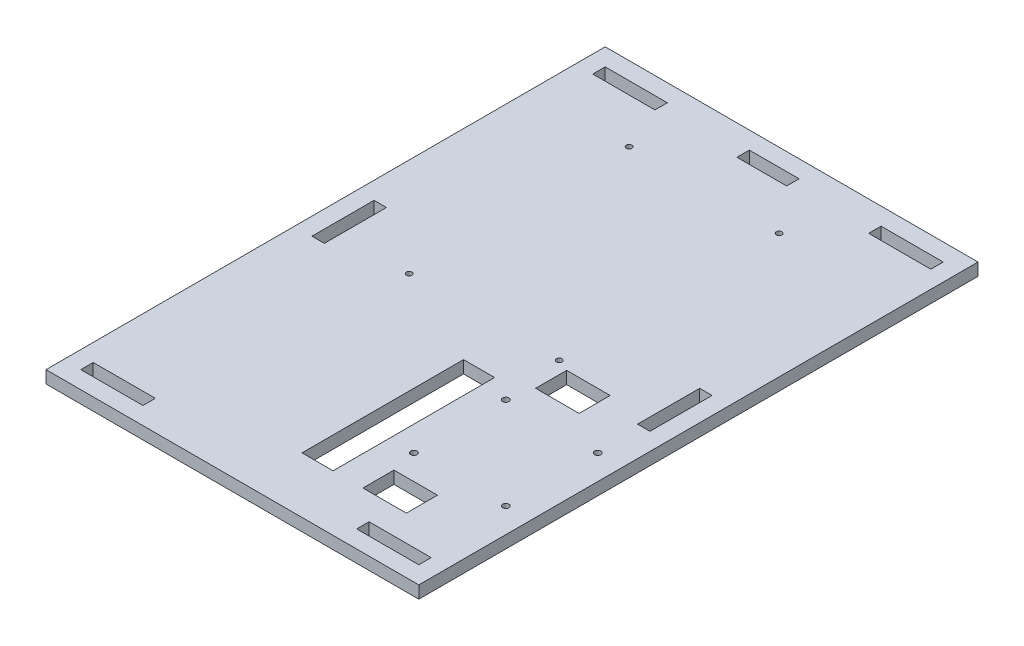
from build123d import *

# Parameters (mm, degrees)
SKETCH1_W           = 150
SKETCH1_H           = 225
BOSS_EXTRUDE1_DEPTH = 5
SKETCH2_R           = 1.125
CUT_EXTRUDE1_DEPTH  = 136.300591277
SKETCH3_R           = 1.275
CUT_EXTRUDE2_DEPTH  = 136.300591277
SKETCH6_W           = 20
SKETCH6_H           = 5
CUT_EXTRUDE3_DEPTH  = 136.300591277
SKETCH9_W           = 12.5
SKETCH9_H           = 65
SKETCH9_W_2         = 17.5
SKETCH9_H_2         = 12.5
CUT_EXTRUDE4_DEPTH  = 5
SKETCH10_W          = 25
SKETCH10_H          = 5
SKETCH10_W_2        = 5
SKETCH10_H_2        = 25
CUT_EXTRUDE5_DEPTH  = 5


with BuildPart() as part:
    # Sketch1 → Boss-Extrude1 (new body)
    with BuildSketch(Plane(origin=(0, 0, 0), x_dir=(1, 0, 0), z_dir=(0, 1, 0))):
        Rectangle(SKETCH1_W, SKETCH1_H)
    extrude(amount=BOSS_EXTRUDE1_DEPTH)

    # Sketch2 → Cut-Extrude1 (cut, through all)
    with BuildSketch(Plane(origin=(0, 5, 0), x_dir=(1, 0, 0), z_dir=(0, 1, 0))):
        with Locations(Location((-35.35, 82.5, 0), (0, 0, 270))):
            Circle(SKETCH2_R)
        with Locations(Location((25, 82.5, 0), (0, 0, 270))):
            Circle(SKETCH2_R)
        with Locations(Location((25, -6, 0), (0, 0, 270))):
            Circle(SKETCH2_R)
        with Locations(Location((-35.35, -6, 0), (0, 0, 270))):
            Circle(SKETCH2_R)
    extrude(amount=-CUT_EXTRUDE1_DEPTH, mode=Mode.SUBTRACT)

    # Sketch3 → Cut-Extrude2 (cut, through all)
    with BuildSketch(Plane(origin=(0, 5, 0), x_dir=(1, 0, 0), z_dir=(0, 1, 0))):
        with Locations(Location((28, -30.5, 0), (0, 0, 270))):
            Circle(SKETCH3_R)
        with Locations(Location((65, -30.5, 0), (0, 0, 270))):
            Circle(SKETCH3_R)
        with Locations(Location((65, -67.5, 0), (0, 0, 270))):
            Circle(SKETCH3_R)
        with Locations(Location((28, -67.5, 0), (0, 0, 270))):
            Circle(SKETCH3_R)
    extrude(amount=-CUT_EXTRUDE2_DEPTH, mode=Mode.SUBTRACT)

    # Sketch6 → Cut-Extrude3 (cut, through all)
    with BuildSketch(Plane(origin=(0, 5, 0), x_dir=(1, 0, 0), z_dir=(0, 1, 0))):
        with Locations((0, 103)):
            Rectangle(SKETCH6_W, SKETCH6_H)
    extrude(amount=-CUT_EXTRUDE3_DEPTH, mode=Mode.SUBTRACT)

    # Sketch9 → Cut-Extrude4 (cut)
    with BuildSketch(Plane(origin=(0, 5, 0), x_dir=(1, 0, 0), z_dir=(0, 1, 0))):
        with Locations((11.75, -57.5)):
            Rectangle(SKETCH9_W, SKETCH9_H)
        with Locations((38.75, -14.25)):
            Rectangle(SKETCH9_W_2, SKETCH9_H_2)
        with Locations((38.75, -83.75)):
            Rectangle(SKETCH9_W_2, SKETCH9_H_2)
    extrude(amount=-CUT_EXTRUDE4_DEPTH, mode=Mode.SUBTRACT)

    # Sketch10 → Cut-Extrude5 (cut)
    with BuildSketch(Plane(origin=(0, 5, 0), x_dir=(1, 0, 0), z_dir=(0, 1, 0))):
        with Locations((-55.5, -103)):
            Rectangle(SKETCH10_W, SKETCH10_H)
        with Locations((-55.5, 103)):
            Rectangle(SKETCH10_W, SKETCH10_H)
        with Locations((55.5, -103)):
            Rectangle(SKETCH10_W, SKETCH10_H)
        with Locations((55.5, 103)):
            Rectangle(SKETCH10_W, SKETCH10_H)
        with Locations((65.5, 0)):
            Rectangle(SKETCH10_W_2, SKETCH10_H_2)
        with Locations((-65.5, 0)):
            Rectangle(SKETCH10_W_2, SKETCH10_H_2)
    extrude(amount=-CUT_EXTRUDE5_DEPTH, mode=Mode.SUBTRACT)


solid = part.part
